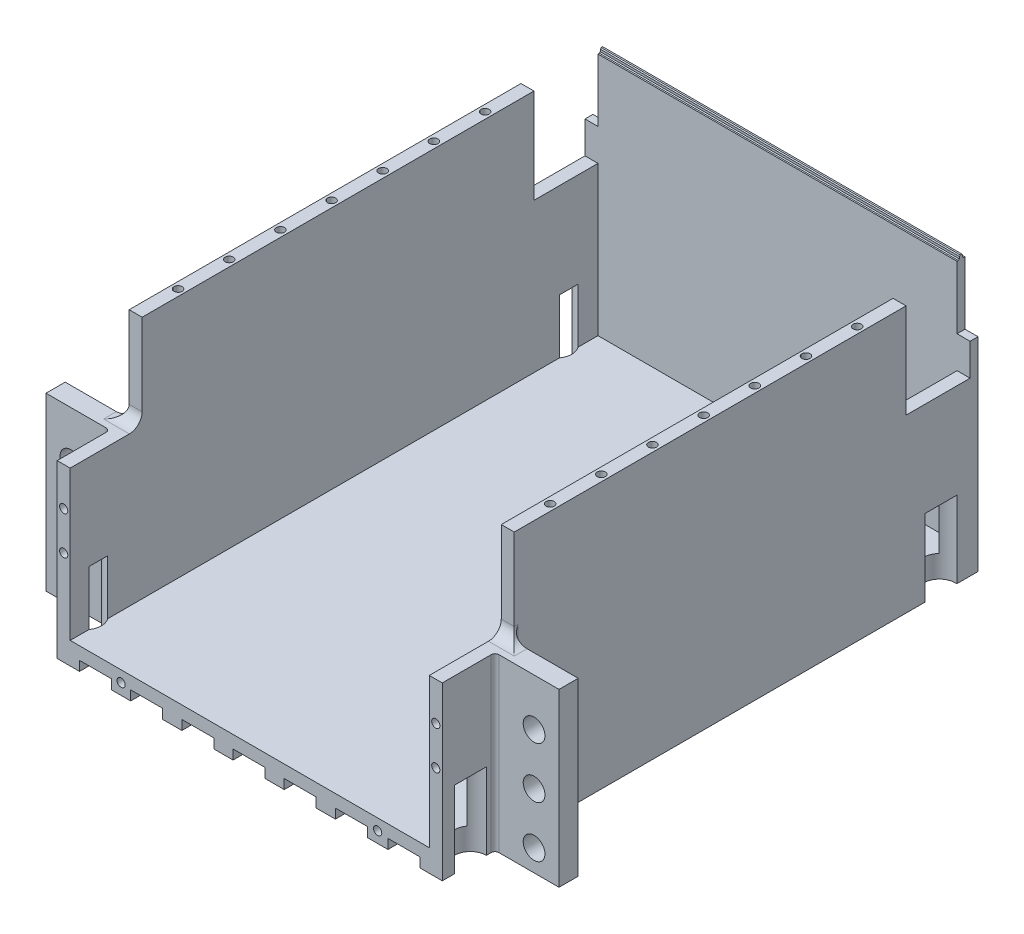
from build123d import *

# Parameters (mm, degrees)
BASE_DEPTH         = 52.831999999999994
BATTERY_HOLE_DEPTH = 48.4251
EXTRUDE3_DEPTH     = 52.831999999999994
FILLET1_R          = 0.762
SKETCH6_W          = 6.350000000000001
SKETCH6_H          = 1.904999999999987
SKETCH6_W_2        = 6.349999999999994
EXTRUDE5_DEPTH     = 106.3625
SKETCH5_R          = 0.812800000000009
SKETCH5_R_2        = 0.8128000000000078
SKETCH5_R_3        = 0.812799999999968
EXTRUDE6_DEPTH     = 9.525
SKETCH10_R         = 3.1749999999999976
SKETCH10_R_2       = 3.1750000000000003
EXTRUDE8_DEPTH     = 15.239999999999998
SKETCH12_W         = 14.28749999999998
SKETCH12_H         = 18.795999999999985
EXTRUDE9_DEPTH     = 157.4558690054483
SKETCH13_R         = 0.8128000000000039
SKETCH13_R_2       = 0.8128000000000078
SKETCH13_R_3       = 0.812800000000012
EXTRUDE10_DEPTH    = 10
SKETCH16_R         = 3.174999999999997
EXTRUDE13_DEPTH    = 15.239999999999998
SKETCH17_W         = 76.454
SKETCH17_H         = 1.5747999999999962
EXTRUDE14_DEPTH    = 6.35
SKETCH19_R         = 2.158999999999993
SKETCH19_R_2       = 2.159
SKETCH19_R_3       = 2.158999999999994
EXTRUDE15_DEPTH    = 14.2875
SKETCH20_R         = 0.8128000000000078
SKETCH20_R_2       = 0.8127999999999996
EXTRUDE16_DEPTH    = 9.525
SKETCH22_W         = 71.2978
SKETCH22_H         = 1.5747999999999962
EXTRUDE17_DEPTH    = 12.446
SKETCH24_W         = 5.020847259377149
SKETCH24_H         = 12.98126293619711
SKETCH24_W_2       = 5.020847259377153
SKETCH24_H_2       = 12.9812629361971
EXTRUDE18_DEPTH    = 18.796
FILLET2_R          = 2.54
SKETCH25_W         = 71.29779999999998
SKETCH25_H         = 0.6667500000000075
EXTRUDE19_DEPTH    = 0.79375
CHAMFER1_SIZE      = 0.1778


with BuildPart() as part:
    # Sketch1 → base (new body)
    with BuildSketch(Plane(origin=(0, 0, 0), x_dir=(1, 0, 0), z_dir=(0, 1, 0))):
        Polygon((0, 0), (-76.454, 4.51e-15), (-76.454, 106.3625), (0, 106.3625), align=None)
    extrude(amount=-BASE_DEPTH)

    # Sketch2 → battery hole (cut)
    with BuildSketch(Plane(origin=(0, 0, 0), x_dir=(1, 0, 0), z_dir=(0, 1, 0))):
        Polygon((-73.8759, 104.78769999999999), (-2.5781000000000067, 104.78769999999999), (-2.578100000000014, 0), (-73.87589999999999, 0), align=None)
    extrude(amount=-BATTERY_HOLE_DEPTH, mode=Mode.SUBTRACT)

    # Sketch4 → Extrude3 (add)
    with BuildSketch(Plane(origin=(0, 0, 0), x_dir=(-1, 0, 0), z_dir=(0, 1, 0))):
        Polygon((76.45400000000001, -14.287499999999994), (89.154, -14.287499999999994), (89.154, -10.477499999999996), (76.45400000000001, -10.477499999999997), align=None)
        Polygon((0, -10.477499999999997), (0, -14.287499999999994), (-12.699999999999989, -14.287499999999994), (-12.699999999999989, -10.477499999999996), align=None)
    extrude(amount=-EXTRUDE3_DEPTH)

    # Fillet1
    fillet1_edges = [part.edges().sort_by_distance(p)[0] for p in [
        (0, -26.415999999999997, -14.287499999999994),
        (-76.45400000000001, -26.415999999999997, -14.287499999999994),
        (0, -26.415999999999997, -10.477499999999997),
        (-76.45400000000001, -26.415999999999997, -10.477499999999997),
    ]]
    fillet(fillet1_edges, radius=FILLET1_R)

    # Sketch6 → Extrude5 (cut)
    with BuildSketch(Plane.XY):
        with Locations((-58.68648014601246, -51.8795)):
            Rectangle(SKETCH6_W, SKETCH6_H)
        with Locations((-48.526480146012446, -51.8795)):
            Rectangle(SKETCH6_W_2, SKETCH6_H)
        with Locations((-38.366480146012435, -51.8795)):
            Rectangle(SKETCH6_W_2, SKETCH6_H)
        with Locations((-28.20648014601243, -51.8795)):
            Rectangle(SKETCH6_W_2, SKETCH6_H)
        with Locations((-18.046480146012428, -51.8795)):
            Rectangle(SKETCH6_W_2, SKETCH6_H)
        with Locations((-7.60751985398754, -51.8795)):
            Rectangle(SKETCH6_W_2, SKETCH6_H)
        with Locations((-68.84648014601245, -51.8795)):
            Rectangle(SKETCH6_W_2, SKETCH6_H)
    extrude(amount=-EXTRUDE5_DEPTH, mode=Mode.SUBTRACT)

    # Sketch5 → Extrude6 (cut)
    with BuildSketch(Plane.XY):
        with Locations((-75.16494999999998, -26.415999999999993)):
            Circle(SKETCH5_R)
        with Locations((-75.16494999999985, -34.03599999999999)):
            Circle(SKETCH5_R_2)
        with Locations((-1.289050000000194, -34.035999999999994)):
            Circle(SKETCH5_R_3)
        with Locations((-1.2890500000000276, -26.415999999999997)):
            Circle(SKETCH5_R)
    extrude(amount=-EXTRUDE6_DEPTH, mode=Mode.SUBTRACT)

    # Sketch10 → Extrude8 (cut)
    with BuildSketch(Plane.XZ.offset(52.831999999999994)):
        with Locations((-76.454, -5.587999999999997)):
            Circle(SKETCH10_R)
        with Locations((0, -5.587999999999997)):
            Circle(SKETCH10_R_2)
    extrude(amount=-EXTRUDE8_DEPTH, mode=Mode.SUBTRACT)

    # Sketch12 → Extrude9 (cut, through all)
    with BuildSketch(Plane(origin=(12.699999999999989, 0, 0), x_dir=(0, 0, -1), z_dir=(1, 0, 0))):
        Polygon((0, 0), (14.287499999999994, 0), (14.287499999999994, -18.796), (2.3e-15, -18.796), align=None)
        with Locations((99.21875, -9.397999999999993)):
            Rectangle(SKETCH12_W, SKETCH12_H)
    extrude(amount=-EXTRUDE9_DEPTH, mode=Mode.SUBTRACT)

    # Sketch13 → Extrude10 (cut)
    with BuildSketch(Plane(origin=(0, 0, 0), x_dir=(-1, 0, 0), z_dir=(0, 1, 0))):
        with Locations(Location((75.16495000000032, -83.66125, 0), (0, 0, 90))):
            Circle(SKETCH13_R)
        with Locations(Location((75.1649500000002, -73.50125, 0), (0, 0, 90))):
            Circle(SKETCH13_R_2)
        with Locations(Location((75.16494999999995, -43.021249999999995, 0), (0, 0, 90))):
            Circle(SKETCH13_R_2)
        with Locations(Location((1.289050000000111, -22.701249999999998, 0), (0, 0, 90))):
            Circle(SKETCH13_R_2)
        with Locations(Location((1.2890499999996945, -83.66125, 0), (0, 0, 90))):
            Circle(SKETCH13_R)
        with Locations(Location((1.2890499999998055, -73.50125000000001, 0), (0, 0, 90))):
            Circle(SKETCH13_R_3)
        with Locations(Location((75.1649500000001, -63.34125, 0), (0, 0, 90))):
            Circle(SKETCH13_R_2)
        with Locations(Location((75.16494999999999, -53.18125, 0), (0, 0, 90))):
            Circle(SKETCH13_R_2)
        with Locations(Location((75.16494999999992, -32.86124999999999, 0), (0, 0, 90))):
            Circle(SKETCH13_R_2)
        with Locations(Location((75.16494999999988, -22.701249999999998, 0), (0, 0, 90))):
            Circle(SKETCH13_R_2)
        with Locations(Location((1.2890500000000693, -32.86124999999999, 0), (0, 0, 270))):
            Circle(SKETCH13_R_2)
        with Locations(Location((1.2890500000000416, -43.021249999999995, 0), (0, 0, 270))):
            Circle(SKETCH13_R_2)
        with Locations(Location((1.2890500000000138, -53.18125, 0), (0, 0, 270))):
            Circle(SKETCH13_R_2)
        with Locations(Location((1.2890499999999028, -63.34125, 0), (0, 0, 270))):
            Circle(SKETCH13_R_2)
    extrude(amount=-EXTRUDE10_DEPTH, mode=Mode.SUBTRACT)

    # Sketch16 → Extrude13 (cut)
    with BuildSketch(Plane.XZ.offset(52.831999999999994)):
        with Locations((-76.454, -98.9965)):
            Circle(SKETCH16_R)
        with Locations((-0.27896029202487127, -98.9965)):
            Circle(SKETCH16_R)
    extrude(amount=-EXTRUDE13_DEPTH, mode=Mode.SUBTRACT)

    # Sketch17 → Extrude14 (add)
    with BuildSketch(Plane(origin=(0, -18.795999999999985, 0), x_dir=(1, 0, 0), z_dir=(0, 1, 0))):
        with Locations((-38.227, 105.57509999999999)):
            Rectangle(SKETCH17_W, SKETCH17_H)
    extrude(amount=EXTRUDE14_DEPTH)

    # Sketch19 → Extrude15 (cut)
    with BuildSketch(Plane.XY):
        with Locations((-84.201, -48.513999999999996)):
            Circle(SKETCH19_R)
        with Locations((-84.201, -38.35399999999999)):
            Circle(SKETCH19_R)
        with Locations((7.747000000000003, -48.513999999999996)):
            Circle(SKETCH19_R_2)
        with Locations((7.747000000000003, -38.35399999999999)):
            Circle(SKETCH19_R_2)
        with Locations((-84.201, -28.19399999999999)):
            Circle(SKETCH19_R_3)
        with Locations((7.747000000000003, -28.19399999999999)):
            Circle(SKETCH19_R_3)
    extrude(amount=-EXTRUDE15_DEPTH, mode=Mode.SUBTRACT)

    # Sketch20 → Extrude16 (cut)
    with BuildSketch(Plane.XY):
        with Locations((-63.766480146012455, -50.62855)):
            Circle(SKETCH20_R)
        with Locations((-12.826999999999984, -50.62855)):
            Circle(SKETCH20_R_2)
    extrude(amount=-EXTRUDE16_DEPTH, mode=Mode.SUBTRACT)

    # Sketch22 → Extrude17 (add)
    with BuildSketch(Plane(origin=(0, -12.445999999999987, 0), x_dir=(1, 0, 0), z_dir=(0, 1, 0))):
        with Locations((-38.227000000000004, 105.57509999999999)):
            Rectangle(SKETCH22_W, SKETCH22_H)
    extrude(amount=EXTRUDE17_DEPTH)

    # Sketch24 → Extrude18 (cut)
    with BuildSketch(Plane(origin=(0, 0, 0), x_dir=(1, 0, 0), z_dir=(0, 1, 0))):
        with Locations((-78.96442362968857, 11.223602435904425)):
            Rectangle(SKETCH24_W, SKETCH24_H)
        with Locations((2.5104236296885767, 11.223602435904418)):
            Rectangle(SKETCH24_W_2, SKETCH24_H_2)
    extrude(amount=-EXTRUDE18_DEPTH, mode=Mode.SUBTRACT)

    # Fillet2
    fillet2_edges = [part.edges().sort_by_distance(p)[0] for p in [
        (-1.2890500000000067, -18.796, -14.287499999999994),
        (-75.16494999999999, -18.796, -14.287499999999994),
        (-76.454, -18.796, -14.668499999999995),
        (0, -18.796, -14.668499999999995),
    ]]
    fillet(fillet2_edges, radius=FILLET2_R)

    # Sketch25 → Extrude19 (add)
    with BuildSketch(Plane(origin=(0, 0, 0), x_dir=(1, 0, 0), z_dir=(0, 1, 0))):
        with Locations((-38.227, 105.57509999999996)):
            Rectangle(SKETCH25_W, SKETCH25_H)
    extrude(amount=EXTRUDE19_DEPTH)

    # Chamfer1
    chamfer1_edges = [part.edges().sort_by_distance(p)[0] for p in [
        (-38.227, 0.79375, -105.90847499999997),
        (-38.227, 0.79375, -105.24172499999997),
        (-38.227, 0, -105.24172499999997),
        (-38.227, 0, -105.90847499999997),
    ]]
    chamfer(chamfer1_edges, length=CHAMFER1_SIZE)


solid = part.part
